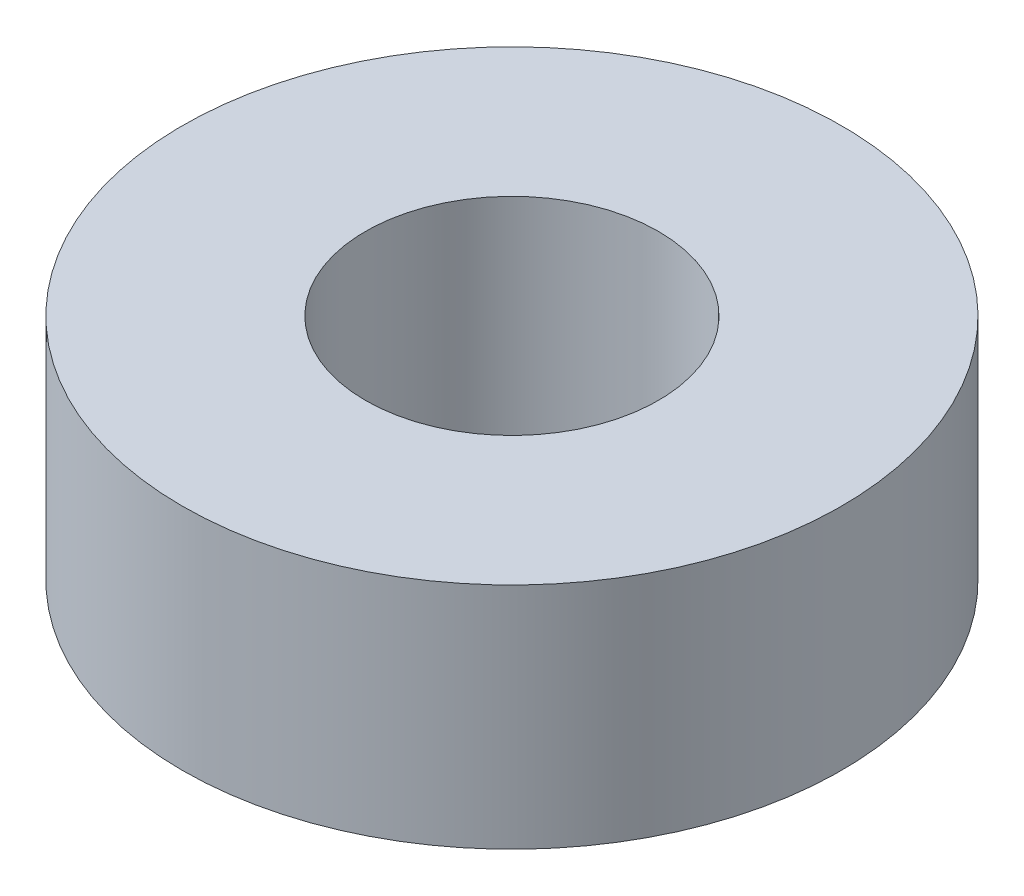
from build123d import *

# Parameters (mm, degrees)
SKETCH_1_R      = 3.6
SKETCH_1_R_2    = 1.6
EXTRUDE_1_DEPTH = 2.5


with BuildPart() as part:
    # 草图1 → 凸台-拉伸1 (new body)
    with BuildSketch(Plane(origin=(0, 0, 0), x_dir=(1, 0, 0), z_dir=(0, 1, 0))):
        with Locations(Location((0, 0, 0), (0, 0, 270))):
            Circle(SKETCH_1_R)
        with Locations(Location((0, 0, 0), (0, 0, 270))):
            Circle(SKETCH_1_R_2, mode=Mode.SUBTRACT)
    extrude(amount=EXTRUDE_1_DEPTH)


solid = part.part
